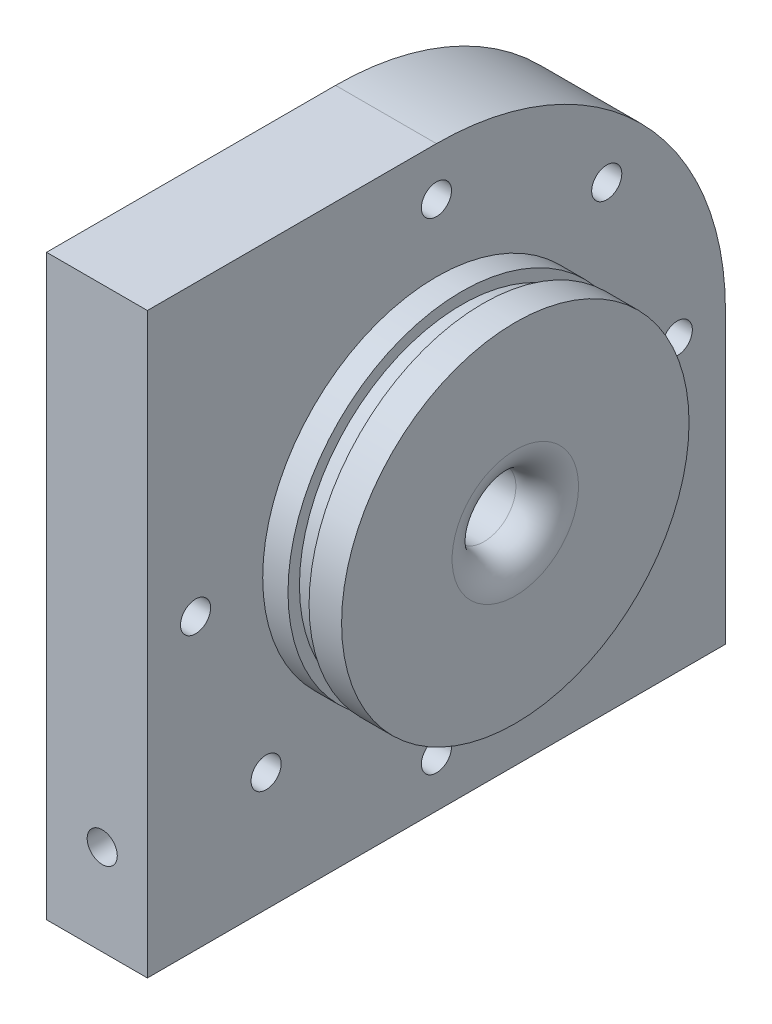
from build123d import *

# Parameters (mm, degrees)
SKETCH1_R                     = 36.6395
HOUSING_FITTING_EXTRUDE_DEPTH = 16.637
HOUSING_BODY_1_DEPTH          = 21.2725
SKETCH3_R                     = 6.731
IMPELLER_BORE_DEPTH           = 17.018
SKETCH4_R                     = 4
SHAFT_BORE_DEPTH              = 20.8915
O_RING_CUT_DEPTH              = 1.27
O_RING_CUT_DEPTH_BACK         = 3.175
SKETCH5_R                     = 36.6395
SKETCH5_R_2                   = 34.2265
SKETCH12_R                    = 3.175
CUT_EXTRUDE2_DEPTH            = 21.2725
CIRPATTERN1_COUNT             = 8
SKETCH13_R                    = 3.175
CUT_EXTRUDE3_DEPTH            = 16.51
SKETCH14_R                    = 3.175
SKETCH14_R_2                  = 3.392842108
CUT_EXTRUDE4_DEPTH            = 16.51
SKETCH15_R                    = 3.175
CUT_EXTRUDE5_DEPTH            = 10.922
FILLET1_R                     = 6.604
SKETCH17_R                    = 17.5006
CUT_EXTRUDE8_DEPTH            = 25.2095
BOSS_EXTRUDE1_START           = 6.35
SKETCH18_R                    = 17.5006
SKETCH18_R_2                  = 15.875
BOSS_EXTRUDE1_DEPTH           = 6.35


with BuildPart() as part:
    # Sketch1 → Housing Fitting Extrude (new body)
    with BuildSketch(Plane(origin=(0, 0, 0), x_dir=(0, 0, -1), z_dir=(1, 0, 0))):
        Circle(SKETCH1_R)
    extrude(amount=HOUSING_FITTING_EXTRUDE_DEPTH)

    # Sketch2 → Housing Body 1 (add)
    with BuildSketch(Plane.ZY):
        with BuildLine():
            Line((60.96, 0), (60.96, 60.96))
            Line((60.96, 60.96), (0, 60.96))
            ThreePointArc((0, 60.96), (-43.105229381, 43.105229381), (-60.96, 0))
            Line((-60.96, 0), (-60.96, -54.61))
            Line((-60.96, -54.61), (-60.96, -60.96))
            Line((-60.96, -60.96), (60.96, -60.96))
            Line((60.96, -60.96), (60.96, -54.61))
            Line((60.96, -54.61), (60.96, 0))
        make_face()
    extrude(amount=HOUSING_BODY_1_DEPTH)

    # Sketch3 → Impeller Bore (cut)
    with BuildSketch(Plane(origin=(16.637, 0, 0), x_dir=(0, 0, -1), z_dir=(1, 0, 0))):
        Circle(SKETCH3_R)
    extrude(amount=-IMPELLER_BORE_DEPTH, mode=Mode.SUBTRACT)

    # Sketch4 → Shaft Bore (cut)
    with BuildSketch(Plane(origin=(-0.381, 0, 0), x_dir=(0, 0, -1), z_dir=(1, 0, 0))):
        Circle(SKETCH4_R)
    extrude(amount=-SHAFT_BORE_DEPTH, mode=Mode.SUBTRACT)

    # Sketch5 → O-Ring Cut (cut, two sides: drawn at the far end of the back side and taken through both)
    with BuildSketch(Plane(origin=(8.509, 0, 0), x_dir=(0, 0, -1), z_dir=(1, 0, 0)).offset(-O_RING_CUT_DEPTH_BACK)):
        Circle(SKETCH5_R)
        Circle(SKETCH5_R_2, mode=Mode.SUBTRACT)
    extrude(amount=O_RING_CUT_DEPTH + O_RING_CUT_DEPTH_BACK, mode=Mode.SUBTRACT)

    # Sketch12 → Cut-Extrude2 (cut)
    with BuildSketch(Plane(origin=(0, 0, 0), x_dir=(0, 0, -1), z_dir=(1, 0, 0))):
        with Locations((-50.8, 0)):
            Circle(SKETCH12_R)
    cut_extrude2 = extrude(amount=-CUT_EXTRUDE2_DEPTH, mode=Mode.SUBTRACT)

    # CirPattern1: Cut-Extrude2 ×8 about axis, 1 skipped
    cirpattern1_axis = Axis((0, 0, 0), (1, 0, 0))
    add([cut_extrude2.rotate(cirpattern1_axis, i * 360 / CIRPATTERN1_COUNT) for i in range(1, CIRPATTERN1_COUNT) if i not in (7,)], mode=Mode.SUBTRACT)

    # Sketch13 → Cut-Extrude3 (cut)
    with BuildSketch(Plane.XY.offset(60.96)):
        with Locations((-9.525, -41.817738443)):
            Circle(SKETCH13_R)
    extrude(amount=-CUT_EXTRUDE3_DEPTH, mode=Mode.SUBTRACT)

    # Sketch14 → Cut-Extrude4 (cut)
    with BuildSketch(Plane.XZ.offset(60.96)):
        with Locations(Location((-9.525, -46.754349092, 0), (0, 0, 270))):
            Circle(SKETCH14_R)
        with Locations(Location((-9.525, 41.914080666, 0), (0, 0, 270))):
            Circle(SKETCH14_R_2)
    extrude(amount=-CUT_EXTRUDE4_DEPTH, mode=Mode.SUBTRACT)

    # Sketch15 → Cut-Extrude5 (cut)
    with BuildSketch(Plane(origin=(0, 0, -60.96), x_dir=(-1, 0, 0), z_dir=(0, 0, -1))):
        with Locations(Location((9.525, -39.337514031, 0), (0, 0, 90))):
            Circle(SKETCH15_R)
    extrude(amount=-CUT_EXTRUDE5_DEPTH, mode=Mode.SUBTRACT)

    # Fillet1
    fillet1_edges = [part.edges().sort_by_distance(p)[0] for p in [
        (16.637, 0, 6.731),
    ]]
    fillet(fillet1_edges, radius=FILLET1_R)

    # Sketch17 → Cut-Extrude8 (cut)
    with BuildSketch(Plane.ZY.offset(21.2725)):
        Circle(SKETCH17_R)
    extrude(amount=-CUT_EXTRUDE8_DEPTH, mode=Mode.SUBTRACT)

    # Sketch18 → Boss-Extrude1 (add)
    with BuildSketch(Plane.ZY.offset(-3.937).offset(BOSS_EXTRUDE1_START)):
        Circle(SKETCH18_R)
        Circle(SKETCH18_R_2, mode=Mode.SUBTRACT)
    extrude(amount=-BOSS_EXTRUDE1_DEPTH)


solid = part.part
